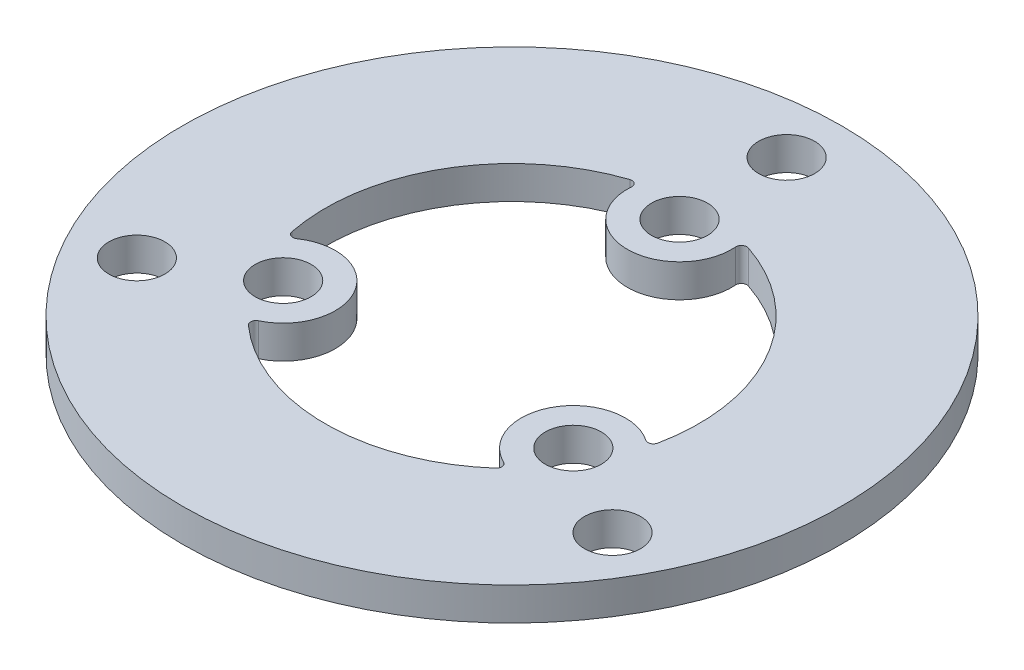
from build123d import *

# Parameters (mm, degrees)
SKETCH1_R           = 30
SKETCH1_R_2         = 17
BOSS_EXTRUDE1_DEPTH = 3
SKETCH2_R           = 4.75
SKETCH2_R_2         = 2.55
BOSS_EXTRUDE2_DEPTH = 3
SKETCH3_R           = 2.55
CUT_EXTRUDE1_DEPTH  = 43.532340636
CIRPATTERN1_COUNT   = 3
FILLET1_R           = 0.5
SKETCH4_R           = 2.55
CUT_EXTRUDE2_DEPTH  = 43.532340784
CIRPATTERN2_COUNT   = 3


with BuildPart() as part:
    # Sketch1 → Boss-Extrude1 (new body)
    with BuildSketch(Plane(origin=(0, 0, 0), x_dir=(1, 0, 0), z_dir=(0, 1, 0))):
        with Locations(Location((0, 0, 0), (0, 0, 270))):
            Circle(SKETCH1_R)
        with Locations(Location((0, 0, 0), (0, 0, 270))):
            Circle(SKETCH1_R_2, mode=Mode.SUBTRACT)
    extrude(amount=BOSS_EXTRUDE1_DEPTH)

    # Sketch2 → Boss-Extrude2 (add)
    with BuildSketch(Plane(origin=(0, 3, 0), x_dir=(1, 0, 0), z_dir=(0, 1, 0))):
        with Locations((0, 15.25)):
            Circle(SKETCH2_R)
        with Locations((0, 15.25)):
            Circle(SKETCH2_R_2, mode=Mode.SUBTRACT)
    boss_extrude2 = extrude(amount=-BOSS_EXTRUDE2_DEPTH)

    # Sketch3 → Cut-Extrude1 (cut, through all)
    with BuildSketch(Plane(origin=(0, 3, 0), x_dir=(1, 0, 0), z_dir=(0, 1, 0))):
        with Locations(Location((0, 15.25, 0), (0, 0, 270))):
            Circle(SKETCH3_R)
    cut_extrude1 = extrude(amount=-CUT_EXTRUDE1_DEPTH, mode=Mode.SUBTRACT)

    # CirPattern1: Boss-Extrude2, Cut-Extrude1 ×3 about axis
    cirpattern1_axis = Axis((0, 0, 0), (0, 1, 0))
    add([boss_extrude2.rotate(cirpattern1_axis, i * 360 / CIRPATTERN1_COUNT) for i in range(1, CIRPATTERN1_COUNT)])
    add([cut_extrude1.rotate(cirpattern1_axis, i * 360 / CIRPATTERN1_COUNT) for i in range(1, CIRPATTERN1_COUNT)], mode=Mode.SUBTRACT)

    # Fillet1
    fillet1_edges = [part.edges().sort_by_distance(p)[0] for p in [
        (-4.618326952, 1.5, -16.360655738),
        (4.618326952, 1.5, -16.360655738),
        (16.477906967, 1.5, 4.180739406),
        (11.859580016, 1.5, 12.179916332),
        (-16.477906967, 1.5, 4.180739406),
        (-11.859580016, 1.5, 12.179916332),
    ]]
    fillet(fillet1_edges, radius=FILLET1_R)

    # Sketch4 → Cut-Extrude2 (cut, through all)
    with BuildSketch(Plane(origin=(0, 3, 0), x_dir=(1, 0, 0), z_dir=(0, 1, 0))):
        with Locations(Location((0, 25, 0), (0, 0, 270))):
            Circle(SKETCH4_R)
    cut_extrude2 = extrude(amount=-CUT_EXTRUDE2_DEPTH, mode=Mode.SUBTRACT)

    # CirPattern2: Cut-Extrude2 ×3 about axis
    cirpattern2_axis = Axis((0, 0, 0), (0, 1, 0))
    for i in range(1, CIRPATTERN2_COUNT):
        add(cut_extrude2.rotate(cirpattern2_axis, i * 360 / CIRPATTERN2_COUNT), mode=Mode.SUBTRACT)


solid = part.part
